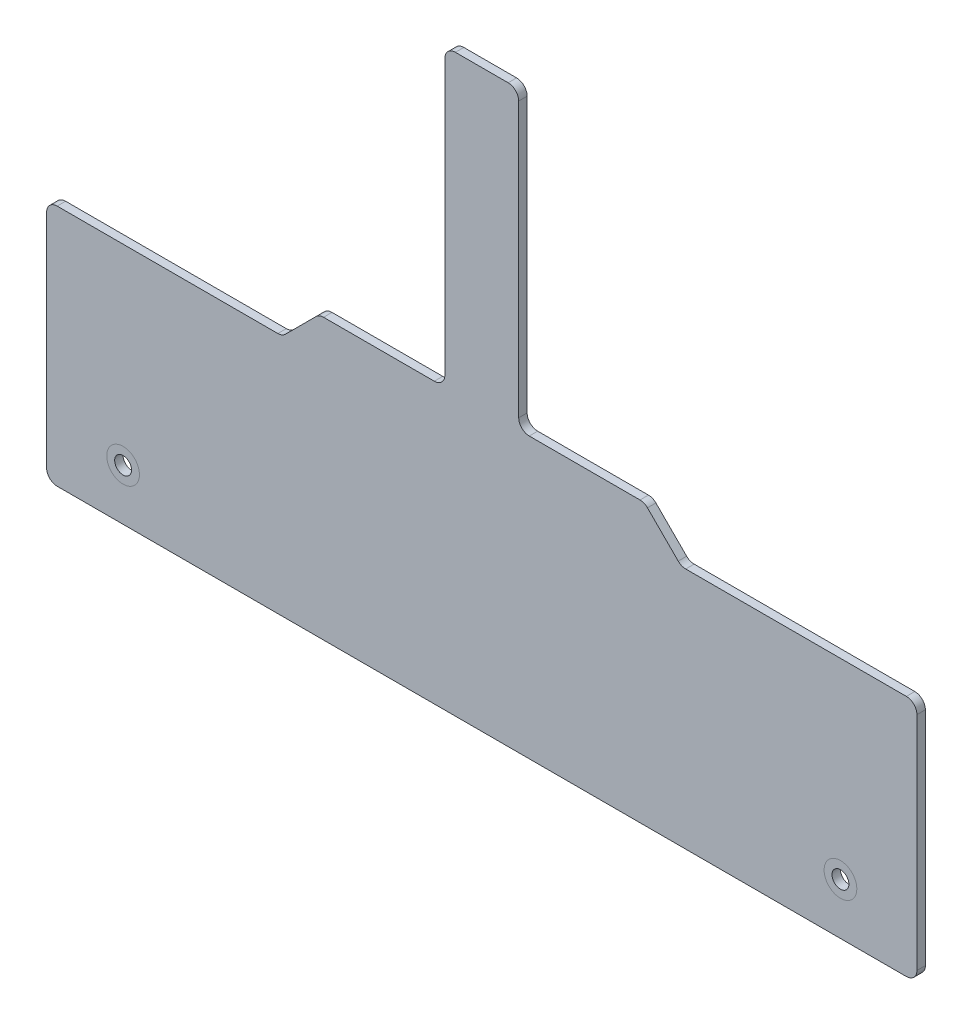
from build123d import *

# Parameters (mm, degrees)
SKETCH2_R           = 1.6
BOSS_EXTRUDE1_DEPTH = 1.6


with BuildPart() as part:
    # Sketch2 → Boss-Extrude1 (new body)
    with BuildSketch(Plane(origin=(0, 7465.170984135, 0), x_dir=(1, 0, 0), z_dir=(0, 0, -1))):
        with BuildLine():
            Line((37.242640687, 7456.585197697), (31.414213562, 7450.756770573))
            ThreePointArc((31.414213562, 7450.756770573), (30.765366865, 7450.32322507), (30, 7450.170984135))
            Line((30, 7450.170984135), (9, 7450.170984135))
            ThreePointArc((9, 7450.170984135), (7.585786438, 7449.585197697), (7, 7448.170984135))
            Line((7, 7448.170984135), (7, 7396.170984135))
            ThreePointArc((7, 7396.170984135), (6.414213562, 7394.756770573), (5, 7394.170984135))
            Line((5, 7394.170984135), (-5, 7394.170984135))
            ThreePointArc((-5, 7394.170984135), (-6.414213562, 7394.756770573), (-7, 7396.170984135))
            Line((-7, 7396.170984135), (-7, 7448.170984135))
            ThreePointArc((-7, 7448.170984135), (-7.585786438, 7449.585197697), (-9, 7450.170984135))
            Line((-9, 7450.170984135), (-30, 7450.170984135))
            ThreePointArc((-30, 7450.170984135), (-30.765366865, 7450.32322507), (-31.414213562, 7450.756770573))
            Line((-31.414213562, 7450.756770573), (-37.242640687, 7456.585197697))
            ThreePointArc((-37.242640687, 7456.585197697), (-37.891487385, 7457.0187432), (-38.656854249, 7457.170984135))
            Line((-38.656854249, 7457.170984135), (-80.5, 7457.170984135))
            ThreePointArc((-80.5, 7457.170984135), (-81.914213562, 7457.756770573), (-82.5, 7459.170984135))
            Line((-82.5, 7459.170984135), (-82.5, 7501.170984135))
            ThreePointArc((-82.5, 7501.170984135), (-81.914213562, 7502.585197697), (-80.5, 7503.170984135))
            Line((-80.5, 7503.170984135), (80.5, 7503.170984135))
            ThreePointArc((80.5, 7503.170984135), (81.914213562, 7502.585197697), (82.5, 7501.170984135))
            Line((82.5, 7501.170984135), (82.5, 7459.170984135))
            ThreePointArc((82.5, 7459.170984135), (81.914213562, 7457.756770573), (80.5, 7457.170984135))
            Line((80.5, 7457.170984135), (38.656854249, 7457.170984135))
            ThreePointArc((38.656854249, 7457.170984135), (37.891487385, 7457.0187432), (37.242640687, 7456.585197697))
        make_face()
        with Locations((-68, 7493.470579606)):
            Circle(SKETCH2_R, mode=Mode.SUBTRACT)
        with Locations((68, 7493.470579606)):
            Circle(SKETCH2_R, mode=Mode.SUBTRACT)
    extrude(amount=BOSS_EXTRUDE1_DEPTH)


solid = part.part
